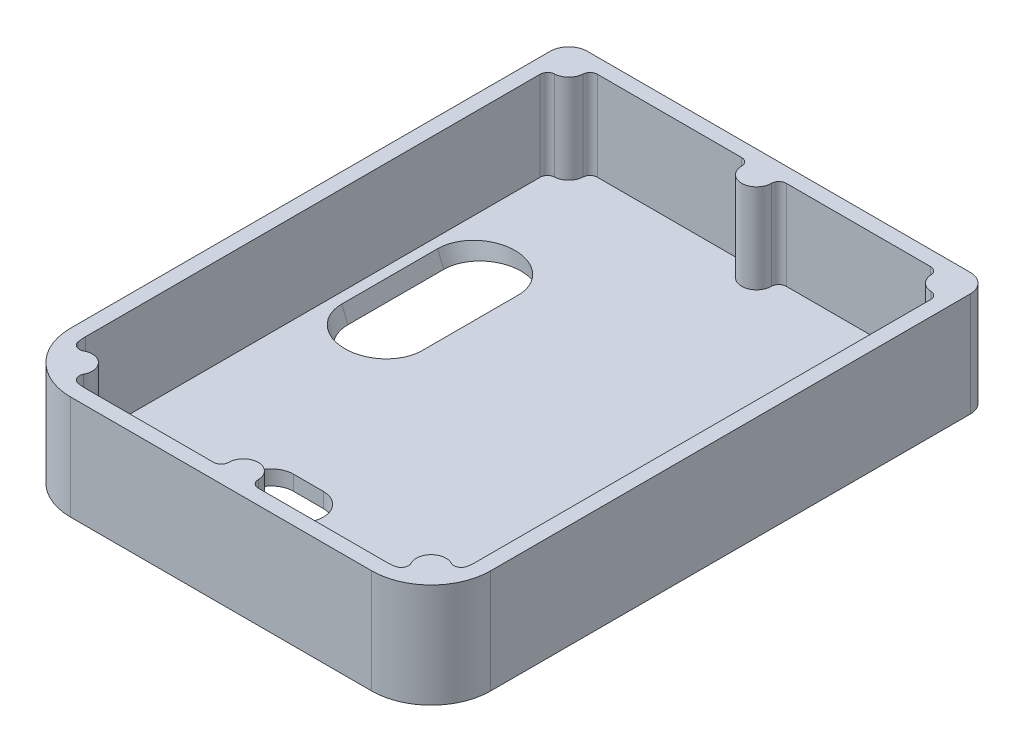
from build123d import *

# Parameters (mm, degrees)
BOSS_EXTRUDE1_DEPTH     = 6.35
BOSS_EXTRUDE2_DEPTH     = 38.1
CUT_EXTRUDE1_DEPTH      = 12.7
CUT_EXTRUDE1_DEPTH_BACK = 25.4
CUT_EXTRUDE2_DEPTH      = 6.35
CUT_EXTRUDE2_DEPTH_BACK = 25.4
CUT_EXTRUDE3_DEPTH      = 156.552724943
BOSS_EXTRUDE3_DEPTH     = 38.1


with BuildPart() as part:
    # Sketch1 → Boss-Extrude1 (new body)
    with BuildSketch(Plane(origin=(0, 0, 0), x_dir=(1, 0, 0), z_dir=(0, 1, 0))):
        with BuildLine():
            Line((-81.75625, 119.0625), (81.75625, 119.0625))
            ThreePointArc((81.75625, 119.0625), (87.368910076, 116.737660076), (89.69375, 111.125))
            Line((89.69375, 111.125), (89.69375, -93.6625))
            ThreePointArc((89.69375, -93.6625), (82.254262242, -111.623012242), (64.29375, -119.0625))
            Line((64.29375, -119.0625), (-64.29375, -119.0625))
            ThreePointArc((-64.29375, -119.0625), (-82.254262242, -111.623012242), (-89.69375, -93.6625))
            Line((-89.69375, -93.6625), (-89.69375, 111.125))
            ThreePointArc((-89.69375, 111.125), (-87.368910076, 116.737660076), (-81.75625, 119.0625))
        make_face()
    extrude(amount=BOSS_EXTRUDE1_DEPTH)

    # Sketch2 → Boss-Extrude2 (add)
    with BuildSketch(Plane(origin=(0, 6.35, 0), x_dir=(1, 0, 0), z_dir=(0, 1, 0))):
        with BuildLine():
            Line((89.69375, -93.6625), (89.69375, 111.125))
            ThreePointArc((89.69375, 111.125), (87.368910076, 116.737660076), (81.75625, 119.0625))
            Line((81.75625, 119.0625), (-81.75625, 119.0625))
            ThreePointArc((-81.75625, 119.0625), (-87.368910076, 116.737660076), (-89.69375, 111.125))
            Line((-89.69375, 111.125), (-89.69375, -93.6625))
            ThreePointArc((-89.69375, -93.6625), (-82.254262242, -111.623012242), (-64.29375, -119.0625))
            Line((-64.29375, -119.0625), (64.29375, -119.0625))
            ThreePointArc((64.29375, -119.0625), (82.254262242, -111.623012242), (89.69375, -93.6625))
        make_face()
        with BuildLine():
            Line((81.75625, 112.7125), (-81.75625, 112.7125))
            ThreePointArc((-81.75625, 112.7125), (-82.878782015, 112.247532015), (-83.34375, 111.125))
            Line((-83.34375, 111.125), (-83.34375, -93.6625))
            ThreePointArc((-83.34375, -93.6625), (-77.764134182, -107.132884182), (-64.29375, -112.7125))
            Line((-64.29375, -112.7125), (64.29375, -112.7125))
            ThreePointArc((64.29375, -112.7125), (77.764134182, -107.132884182), (83.34375, -93.6625))
            Line((83.34375, -93.6625), (83.34375, 111.125))
            ThreePointArc((83.34375, 111.125), (82.878782015, 112.247532015), (81.75625, 112.7125))
        make_face(mode=Mode.SUBTRACT)
    extrude(amount=BOSS_EXTRUDE2_DEPTH)

    # Sketch5 → Cut-Extrude1 (cut, two sides: drawn at the far end of the back side and taken through both)
    with BuildSketch(Plane(origin=(-13.135345572, 31.711529428, 0), x_dir=(0, 0, 1), z_dir=(-0.38268343236509383, 0.9238795325112852, 0)).offset(-CUT_EXTRUDE1_DEPTH_BACK)):
        with BuildLine():
            Line((-52.21366875, -70.394979916), (-11.28633125, -70.394979916))
            add(Edge.make_bspline(
                [(-11.28633125, -70.394979916), (20.46366875, -70.394979916), (20.46366875, -38.644979916), (-11.28633125, -38.644979916)],
                knots=[0, 0, 0, 0, 1, 1, 1, 1], degree=3, weights=[1, 0.333333333, 0.333333333, 1]))
            Line((-11.28633125, -38.644979916), (-52.21366875, -38.644979916))
            add(Edge.make_bspline(
                [(-52.21366875, -70.394979916), (-83.96366875, -70.394979916), (-83.96366875, -38.644979916), (-52.21366875, -38.644979916)],
                knots=[0, 0, 0, 0, 1, 1, 1, 1], degree=3, weights=[1, 0.333333333, 0.333333333, 1]))
        make_face()
    extrude(amount=CUT_EXTRUDE1_DEPTH + CUT_EXTRUDE1_DEPTH_BACK, mode=Mode.SUBTRACT)

    # Sketch7 → Cut-Extrude2 (cut, two sides: drawn at the far end of the back side and taken through both)
    with BuildSketch(Plane(origin=(13.135345572, 31.711529428, 0), x_dir=(0, 0, -1), z_dir=(0.3826834323650874, 0.9238795325112878, 0)).offset(-CUT_EXTRUDE2_DEPTH_BACK)):
        with BuildLine():
            Line((10.20445, -72.146741698), (53.29555, -72.146741698))
            add(Edge.make_bspline(
                [(53.29555, -40.396741698), (85.04555, -40.396741698), (85.04555, -72.146741698), (53.29555, -72.146741698)],
                knots=[0, 0, 0, 0, 1, 1, 1, 1], degree=3, weights=[1, 0.333333333, 0.333333333, 1]))
            Line((53.29555, -40.396741698), (10.20445, -40.396741698))
            add(Edge.make_bspline(
                [(10.20445, -72.146741698), (-21.54555, -72.146741698), (-21.54555, -40.396741698), (10.20445, -40.396741698)],
                knots=[0, 0, 0, 0, 1, 1, 1, 1], degree=3, weights=[1, 0.333333333, 0.333333333, 1]))
        make_face()
    extrude(amount=CUT_EXTRUDE2_DEPTH + CUT_EXTRUDE2_DEPTH_BACK, mode=Mode.SUBTRACT)

    # Sketch8 → Cut-Extrude3 (cut, through all)
    with BuildSketch(Plane.XZ):
        with BuildLine():
            Line((13.49375, 106.83875), (26.19375, 106.83875))
            ThreePointArc((26.19375, 106.83875), (35.71875, 97.31375), (26.19375, 87.78875))
            Line((26.19375, 87.78875), (13.49375, 87.78875))
            ThreePointArc((13.49375, 87.78875), (3.96875, 97.31375), (13.49375, 106.83875))
        make_face()
        with BuildLine():
            Line((-26.19375, 80.9625), (-13.49375, 80.9625))
            ThreePointArc((-13.49375, 80.9625), (-3.96875, 71.4375), (-13.49375, 61.9125))
            Line((-13.49375, 61.9125), (-26.19375, 61.9125))
            ThreePointArc((-26.19375, 61.9125), (-35.71875, 71.4375), (-26.19375, 80.9625))
        make_face()
    extrude(amount=-CUT_EXTRUDE3_DEPTH, mode=Mode.SUBTRACT)

    # Sketch9 → Boss-Extrude3 (add)
    with BuildSketch(Plane(origin=(0, 6.35, 0), x_dir=(1, 0, 0), z_dir=(0, 1, 0))):
        with BuildLine():
            Line((-81.75625, 112.7125), (-71.120073585, 112.7125))
            ThreePointArc((-71.120073585, 112.7125), (-73.309655038, 111.836708137), (-74.291288385, 109.692489328))
            ThreePointArc((-74.291288385, 109.692489328), (-76.143589924, 105.512339924), (-80.323739328, 103.660038385))
            ThreePointArc((-80.323739328, 103.660038385), (-82.467958137, 102.678405038), (-83.34375, 100.488823585))
            Line((-83.34375, 100.488823585), (-83.34375, 111.125))
            ThreePointArc((-83.34375, 111.125), (-82.878782015, 112.247532015), (-81.75625, 112.7125))
        make_face()
        with BuildLine():
            Line((-9.525, -112.7125), (9.525, -112.7125))
            ThreePointArc((9.525, -112.7125), (7.27993597, -111.78256403), (6.35, -109.5375))
            ThreePointArc((6.35, -109.5375), (0, -103.1875), (-6.35, -109.5375))
            ThreePointArc((-6.35, -109.5375), (-7.27993597, -111.78256403), (-9.525, -112.7125))
        make_face()
        with BuildLine():
            Line((-9.525, 112.7125), (9.525, 112.7125))
            ThreePointArc((9.525, 112.7125), (7.27993597, 111.78256403), (6.35, 109.5375))
            ThreePointArc((6.35, 109.5375), (0, 103.1875), (-6.35, 109.5375))
            ThreePointArc((-6.35, 109.5375), (-7.27993597, 111.78256403), (-9.525, 112.7125))
        make_face()
        with BuildLine():
            Line((83.34375, 111.125), (83.34375, 100.488823585))
            ThreePointArc((83.34375, 100.488823585), (82.467958137, 102.678405038), (80.323739328, 103.660038385))
            ThreePointArc((80.323739328, 103.660038385), (76.143589924, 105.512339924), (74.291288385, 109.692489328))
            ThreePointArc((74.291288385, 109.692489328), (73.309655038, 111.836708137), (71.120073585, 112.7125))
            Line((71.120073585, 112.7125), (81.75625, 112.7125))
            ThreePointArc((81.75625, 112.7125), (82.878782015, 112.247532015), (83.34375, 111.125))
        make_face()
        with BuildLine():
            ThreePointArc((-83.049421546, -96.998258512), (-81.324581361, -99.291426622), (-78.45534091, -99.257472557))
            ThreePointArc((-78.45534091, -99.257472557), (-71.028942091, -100.397692091), (-69.888722557, -107.82409091))
            ThreePointArc((-69.888722557, -107.82409091), (-69.922676622, -110.693331361), (-67.629508512, -112.418171546))
            ThreePointArc((-67.629508512, -112.418171546), (-77.764134182, -107.132884182), (-83.049421546, -96.998258512))
        make_face()
        with BuildLine():
            ThreePointArc((69.888722557, -107.82409091), (69.922676622, -110.693331361), (67.629508512, -112.418171546))
            ThreePointArc((67.629508512, -112.418171546), (77.764134182, -107.132884182), (83.049421546, -96.998258512))
            ThreePointArc((83.049421546, -96.998258512), (81.324581361, -99.291426622), (78.45534091, -99.257472557))
            ThreePointArc((78.45534091, -99.257472557), (71.028942091, -100.397692091), (69.888722557, -107.82409091))
        make_face()
    extrude(amount=BOSS_EXTRUDE3_DEPTH)


solid = part.part
